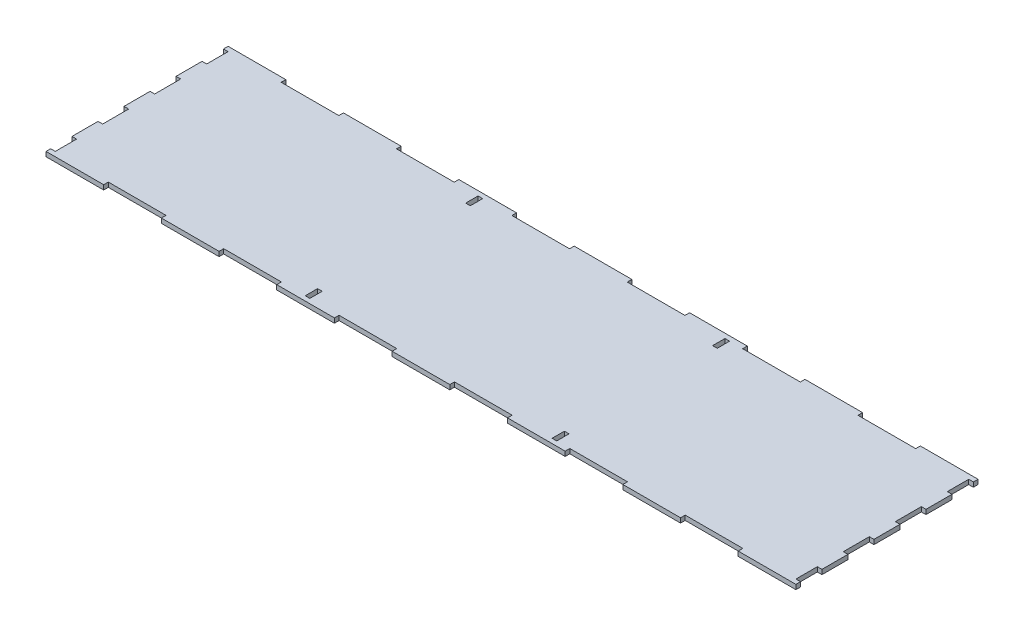
from build123d import *

# Parameters (mm, degrees)
SKETCH1_W           = 54.585576923
SKETCH1_H           = 4.7625
SKETCH1_W_2         = 4.7625
SKETCH1_W_3         = 59.348076923
SKETCH1_H_2         = 26.760714285
SKETCH1_H_3         = 26.760714286
BOSS_EXTRUDE1_DEPTH = 4.7625
SKETCH2_W           = 4.7625
SKETCH2_H           = 12.7
CUT_EXTRUDE1_DEPTH  = 397.998805689


with BuildPart() as part:
    # Sketch1 → Boss-Extrude1 (new body)
    with BuildSketch(Plane(origin=(0, 0, 0), x_dir=(1, 0, 0), z_dir=(0, 1, 0))):
        Polygon((0, -88.9), (0, 88.9), (-29.674038462, 88.9), (-89.022115385, 88.9), (-148.370192308, 88.9), (-207.718269231, 88.9), (-267.066346154, 88.9), (-326.414423077, 88.9), (-381, 88.9), (-381, 66.901785714), (-381, 40.141071429), (-381, 13.380357143), (-381, -13.380357143), (-381, -40.141071429), (-381, -66.901785714), (-381, -88.9), (-326.414423077, -88.9), (-267.066346154, -88.9), (-207.718269231, -88.9), (-148.370192308, -88.9), (-89.022115385, -88.9), (-29.674038462, -88.9), align=None)
        Polygon((29.674038462, 88.9), (0, 88.9), (0, -88.9), (29.674038462, -88.9), (89.022115385, -88.9), (148.370192308, -88.9), (207.718269231, -88.9), (267.066346154, -88.9), (326.414423077, -88.9), (381, -88.9), (381, -66.901785714), (381, -40.141071429), (381, -13.380357143), (381, 13.380357143), (381, 40.141071429), (381, 66.901785714), (381, 88.9), (326.414423077, 88.9), (267.066346154, 88.9), (207.718269231, 88.9), (148.370192308, 88.9), (89.022115385, 88.9), align=None)
        with Locations((-353.707211539, -91.28125)):
            Rectangle(SKETCH1_W, SKETCH1_H)
        with Locations((-383.38125, -91.28125)):
            Rectangle(SKETCH1_W_2, SKETCH1_H)
        with Locations((-237.392307693, -91.28125)):
            Rectangle(SKETCH1_W_3, SKETCH1_H)
        with Locations((-383.38125, -53.521428571)):
            Rectangle(SKETCH1_W_2, SKETCH1_H_2)
        with Locations((-118.696153847, -91.28125)):
            Rectangle(SKETCH1_W_3, SKETCH1_H)
        with Locations((-383.38125, 0)):
            Rectangle(SKETCH1_W_2, SKETCH1_H_3)
        with Locations((-383.38125, 53.521428571)):
            Rectangle(SKETCH1_W_2, SKETCH1_H_2)
        with Locations((-383.38125, 91.28125)):
            Rectangle(SKETCH1_W_2, SKETCH1_H)
        with Locations((-353.707211539, 91.28125)):
            Rectangle(SKETCH1_W, SKETCH1_H)
        with Locations((-237.392307693, 91.28125)):
            Rectangle(SKETCH1_W_3, SKETCH1_H)
        with Locations((-118.696153847, 91.28125)):
            Rectangle(SKETCH1_W_3, SKETCH1_H)
        Polygon((-29.674038462, 88.9), (0, 88.9), (29.674038462, 88.9), (29.674038462, 93.6625), (-29.674038462, 93.6625), align=None)
        with Locations((118.696153847, 91.28125)):
            Rectangle(SKETCH1_W_3, SKETCH1_H)
        Polygon((29.674038462, -88.9), (0, -88.9), (-29.674038462, -88.9), (-29.674038462, -93.6625), (29.674038462, -93.6625), align=None)
        with Locations((118.696153847, -91.28125)):
            Rectangle(SKETCH1_W_3, SKETCH1_H)
        with Locations((237.392307693, -91.28125)):
            Rectangle(SKETCH1_W_3, SKETCH1_H)
        with Locations((237.392307693, 91.28125)):
            Rectangle(SKETCH1_W_3, SKETCH1_H)
        with Locations((383.38125, 91.28125)):
            Rectangle(SKETCH1_W_2, SKETCH1_H)
        with Locations((383.38125, 53.521428571)):
            Rectangle(SKETCH1_W_2, SKETCH1_H_2)
        with Locations((383.38125, 0)):
            Rectangle(SKETCH1_W_2, SKETCH1_H_3)
        with Locations((383.38125, -53.521428571)):
            Rectangle(SKETCH1_W_2, SKETCH1_H_2)
        with Locations((383.38125, -91.28125)):
            Rectangle(SKETCH1_W_2, SKETCH1_H)
        with Locations((356.088461539, -91.28125)):
            Rectangle(SKETCH1_W_3, SKETCH1_H)
        with Locations((356.088461539, 91.28125)):
            Rectangle(SKETCH1_W_3, SKETCH1_H)
    extrude(amount=BOSS_EXTRUDE1_DEPTH)

    # Sketch2 → Cut-Extrude1 (cut, through all)
    with BuildSketch(Plane(origin=(0, 4.7625, 0), x_dir=(1, 0, 0), z_dir=(0, 1, 0))):
        with Locations((-121.44375, 82.55)):
            Rectangle(SKETCH2_W, SKETCH2_H)
        with Locations((-121.44375, -82.55)):
            Rectangle(SKETCH2_W, SKETCH2_H)
        with Locations((132.55625, 82.55)):
            Rectangle(SKETCH2_W, SKETCH2_H)
        with Locations((132.55625, -82.55)):
            Rectangle(SKETCH2_W, SKETCH2_H)
    extrude(amount=-CUT_EXTRUDE1_DEPTH, mode=Mode.SUBTRACT)


solid = part.part
